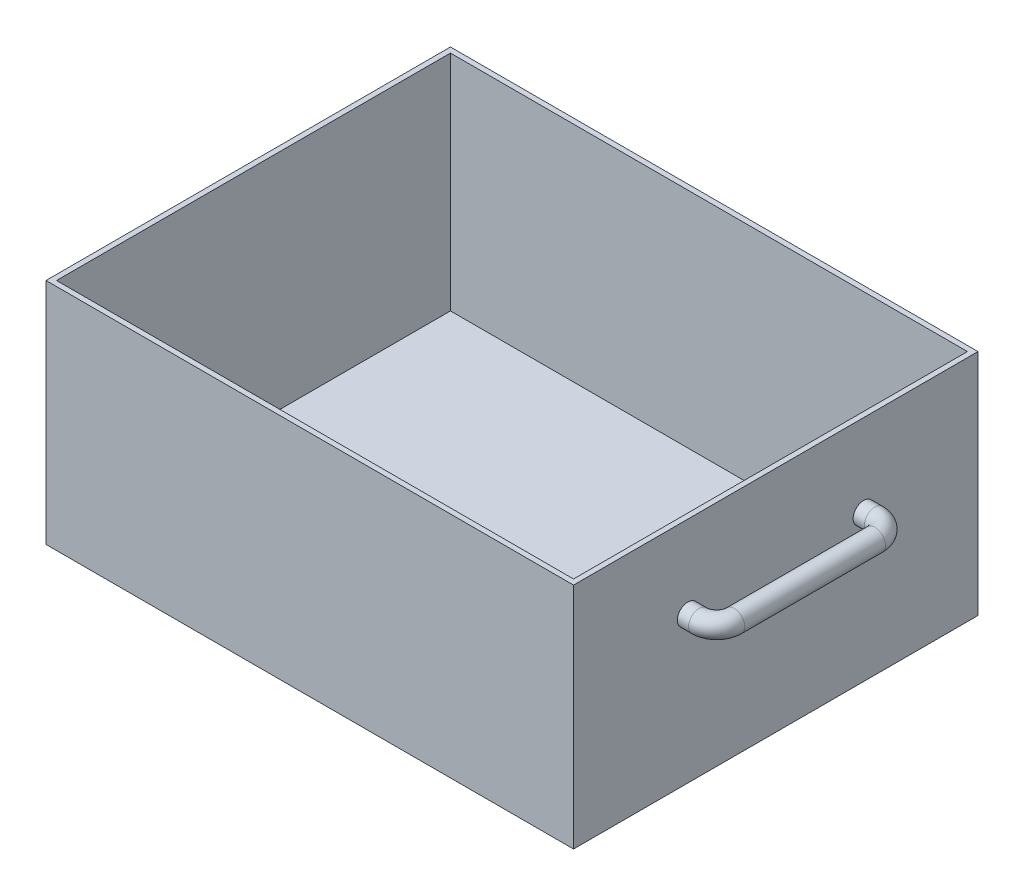
from build123d import *

# Parameters (mm, degrees)
SKETCH1_W           = 300
SKETCH1_H           = 230
BOSS_EXTRUDE1_DEPTH = 130
SHELL1_T            = -3
SKETCH2_R           = 6


with BuildPart() as part:
    # Sketch1 → Boss-Extrude1 (new body)
    with BuildSketch(Plane(origin=(0, 0, 0), x_dir=(1, 0, 0), z_dir=(0, 1, 0))):
        with Locations((13.179916318, 4.874476987)):
            Rectangle(SKETCH1_W, SKETCH1_H)
    extrude(amount=BOSS_EXTRUDE1_DEPTH)

    # Shell1
    shell1_openings = [part.faces().sort_by_distance(p)[0] for p in [
        (13.179916318, 130, -4.874476987),
    ]]
    offset(amount=SHELL1_T, openings=shell1_openings, kind=Kind.INTERSECTION)

    # Sweep2: sweep along a path in Sketch4
    with BuildLine(Plane(origin=(0, 83.172395684, 0), x_dir=(1, 0, 0), z_dir=(0, 1, 0))) as sweep2_path:
        Line((163.179916318, -45.125523013), (169.565605174, -45.125523013))
        ThreePointArc((169.565605174, -45.125523013), (176.636672985, -42.196590824), (179.565605174, -35.125523013))
        Line((179.565605174, -35.125523013), (179.565605174, 44.874476987))
        ThreePointArc((179.565605174, 44.874476987), (176.636672985, 51.945544799), (169.565605174, 54.874476987))
        Line((169.565605174, 54.874476987), (163.179916318, 54.874476987))
    # Sketch2 → Sweep2 (sweep)
    with BuildSketch(Plane(origin=(163.179916318, 0, 0), x_dir=(0, 0, -1), z_dir=(1, 0, 0))):
        with Locations((-45.125523013, 83.172395684)):
            Circle(SKETCH2_R)
    sweep(path=sweep2_path.line)


solid = part.part
